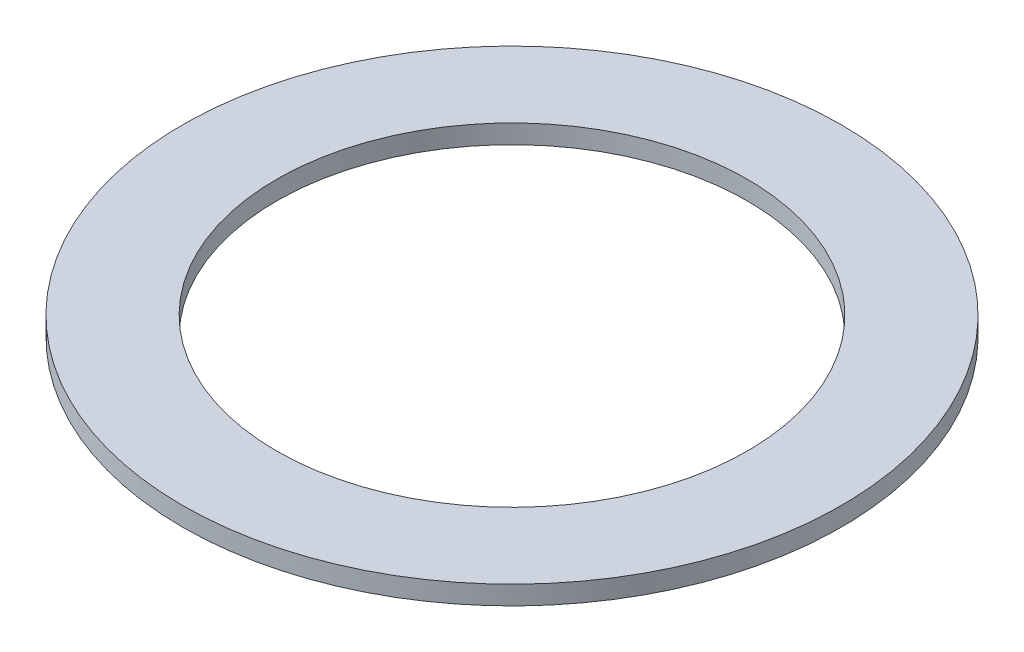
from build123d import *

# Parameters (mm, degrees)
SCHIZZO1_R                   = 35
SCHIZZO1_R_2                 = 25
ESTRUSIONE_ESTRUSIONE1_DEPTH = 2


with BuildPart() as part:
    # Schizzo1 → Estrusione-Estrusione1 (new body)
    with BuildSketch(Plane(origin=(0, 0, 0), x_dir=(1, 0, 0), z_dir=(0, 1, 0))):
        with Locations(Location((0, 0, 0), (0, 0, 270))):
            Circle(SCHIZZO1_R)
        with Locations(Location((0, 0, 0), (0, 0, 270))):
            Circle(SCHIZZO1_R_2, mode=Mode.SUBTRACT)
    extrude(amount=ESTRUSIONE_ESTRUSIONE1_DEPTH)


solid = part.part
